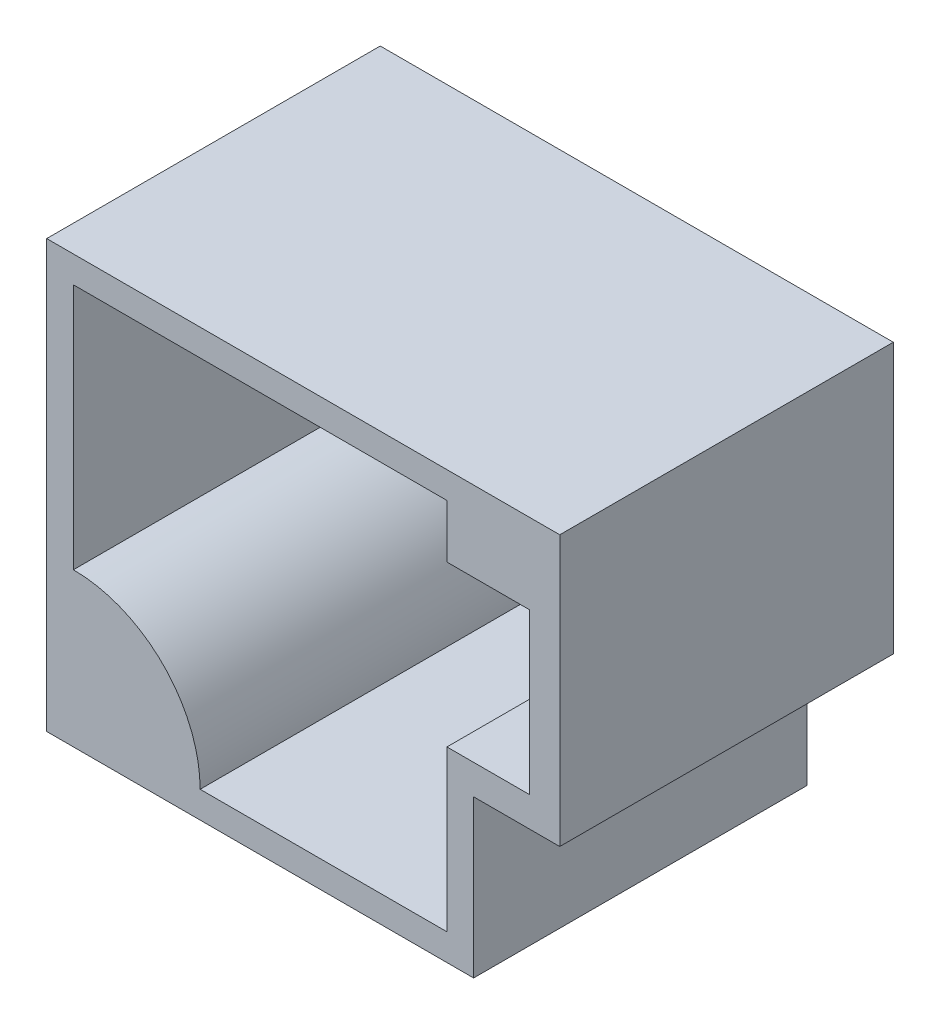
from build123d import *

# Parameters (mm, degrees)
EXTRUDE_1_DEPTH = 250
SKETCH_2_W      = 62
SKETCH_2_H      = 120
EXTRUDE_2_DEPTH = 60


with BuildPart() as part:
    # 草图1 → 凸台-拉伸1 (new body)
    with BuildSketch(Plane.XY):
        Polygon((-160, -160), (160, -160), (160, -42.368693821), (224.572052692, -42.368693821), (224.572052692, 160), (-160, 160), align=None)
        with BuildLine():
            Line((-140, 140), (140, 140))
            Line((140, 140), (140, 100))
            Line((140, 100), (202, 100))
            Line((202, 100), (202, -20))
            Line((202, -20), (140, -20))
            Line((140, -20), (140, -140))
            Line((140, -140), (-45, -140))
            ThreePointArc((-45, -140), (-72.824855787, -72.824855787), (-140, -45))
            Line((-140, -45), (-140, 140))
        make_face(mode=Mode.SUBTRACT)
    extrude(amount=EXTRUDE_1_DEPTH)

    # 草图2 → 凸台-拉伸2 (add)
    with BuildSketch(Plane(origin=(0, 0, 0), x_dir=(-1, 0, 0), z_dir=(0, 0, -1))):
        with Locations((-171, 40)):
            Rectangle(SKETCH_2_W, SKETCH_2_H)
    extrude(amount=-EXTRUDE_2_DEPTH)


solid = part.part
